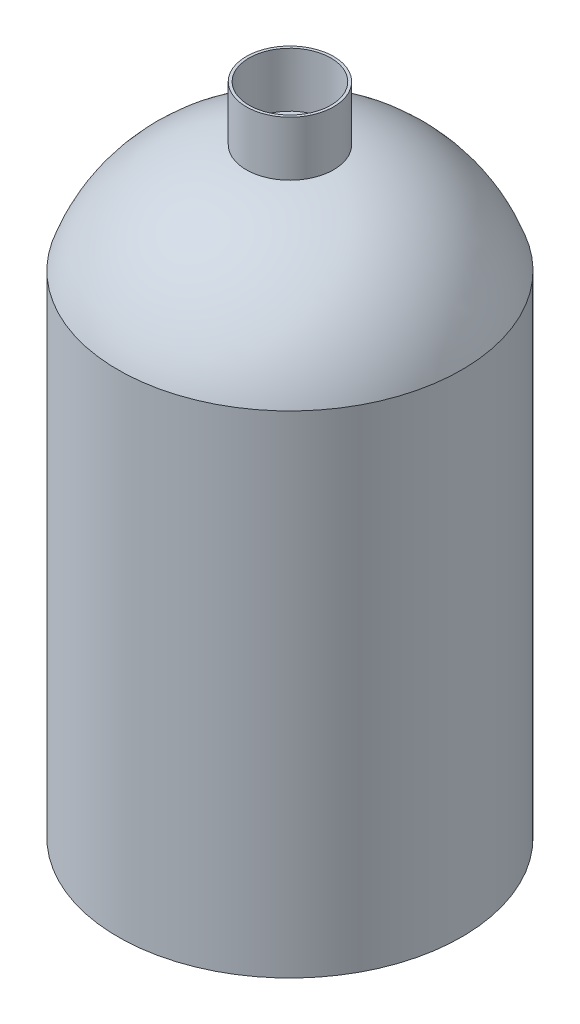
from build123d import *


with BuildPart() as part:
    # Sketch2 → Revolve2 (revolve)
    with BuildSketch(Plane.XY, mode=Mode.PRIVATE) as revolve2_sk:
        with BuildLine():
            Line((0, 0), (0, 22))
            Line((0, 22), (-1.5, 22))
            Line((-1.5, 22), (-1.5, 24))
            Line((-1.5, 24), (-1.6, 24))
            Line((-1.6, 24), (-1.6, 22))
            ThreePointArc((-1.6, 22), (-4.503733623, 20.650637008), (-6.3, 18))
            Line((-6.3, 18), (-6.3, 0))
            Line((-6.3, 0), (0, 0))
        make_face()
    revolve(revolve2_sk.sketch.rotate(Axis((0, 0, 0), (0, 1, 0)), 270), axis=Axis((0, 0, 0), (0, 1, 0)))


solid = part.part
